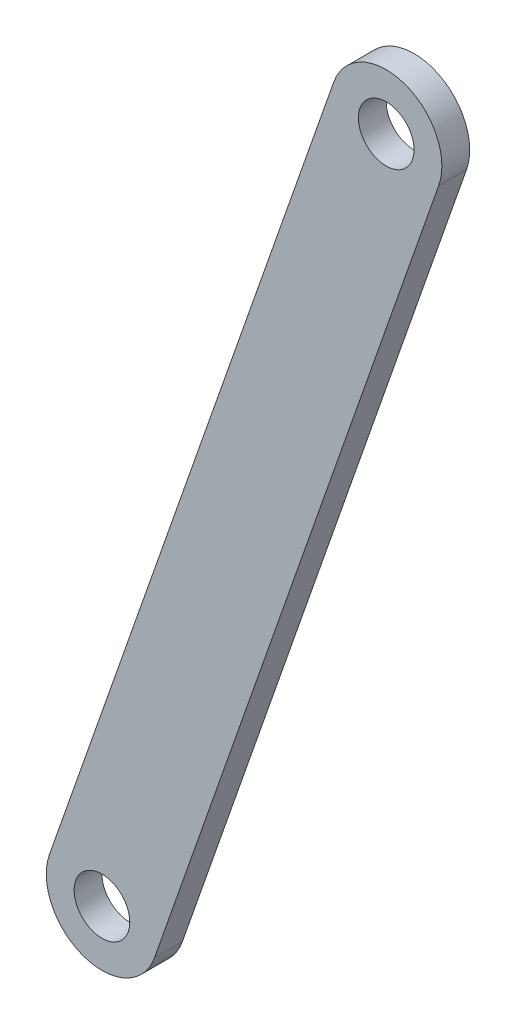
from build123d import *

# Parameters (mm, degrees)
BOSS_EXTRUDE1_START = -1.5875
SKETCH1_R           = 1.5875
BOSS_EXTRUDE1_DEPTH = 1.5875


with BuildPart() as part:
    # Sketch1 → Boss-Extrude1 (new body)
    with BuildSketch(Plane.XY.offset(BOSS_EXTRUDE1_START)):
        with BuildLine():
            Line((-23.955829547, -46.565382641), (-40.163833039, -92.807145397))
            ThreePointArc((-40.163833039, -92.807145397), (-44.210322995, -94.753210411), (-46.156388009, -90.706720455))
            Line((-46.156388009, -90.706720455), (-29.948384516, -44.464957699))
            ThreePointArc((-29.948384516, -44.464957699), (-25.90189456, -42.518892685), (-23.955829547, -46.565382641))
        make_face()
        with Locations((-43.160110524, -91.756932926)):
            Circle(SKETCH1_R, mode=Mode.SUBTRACT)
        with Locations((-26.952107032, -45.51517017)):
            Circle(SKETCH1_R, mode=Mode.SUBTRACT)
    extrude(amount=-BOSS_EXTRUDE1_DEPTH)


solid = part.part
